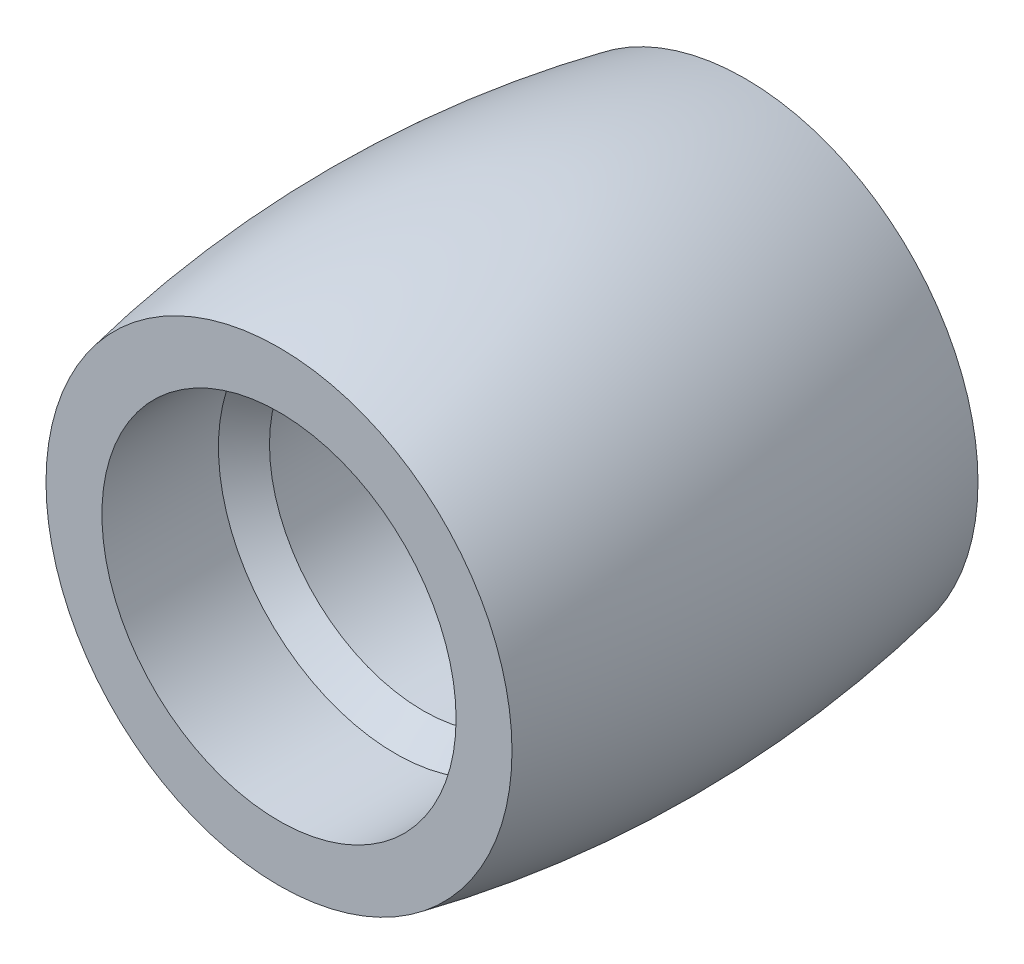
from build123d import *


with BuildPart() as part:
    # Skizze4 → Rotation1 (revolve)
    with BuildSketch(Plane(origin=(0, 0, 0), x_dir=(0, 0, -1), z_dir=(1, 0, 0)), mode=Mode.PRIVATE) as rotation1_sk:
        with BuildLine():
            Line((0, 11), (0, 6.6))
            Line((0, 6.6), (3.808246407, 6.6))
            Line((3.808246407, 6.6), (5, 7.6))
            Line((5, 7.6), (10, 7.6))
            Line((10, 7.6), (10, 10))
            ThreePointArc((10, 10), (5.024937811, 10.749378106), (0, 11))
        make_face()
    revolve(rotation1_sk.sketch.rotate(Axis((0, 0, 10), (0, 0, -1)), 90), axis=Axis((0, 0, 10), (0, 0, -1)))

    # Spiegeln2: part across plane


with BuildPart() as part_1:
    add(part.part)
    add(part.part.mirror(Plane.XY))


solid = part_1.part
